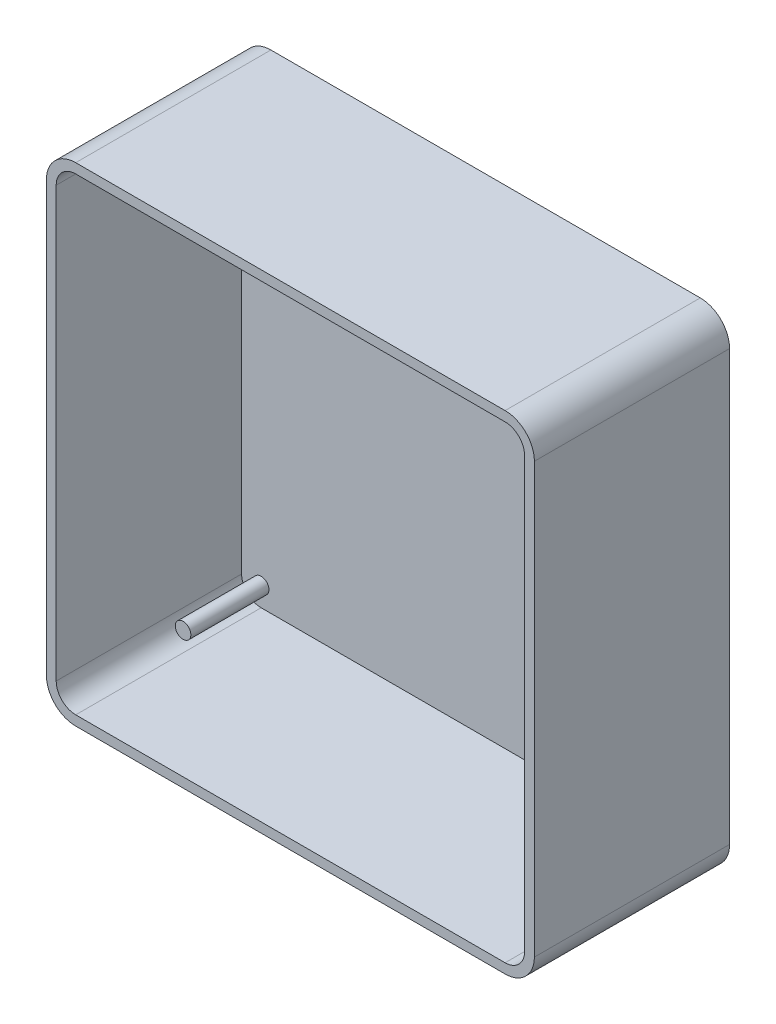
from build123d import *

# Parameters (mm, degrees)
EXTRUDE_4_DEPTH             = 1
EXTRUDE_5_DEPTH             = 19
SKETCH_12_R                 = 0.8
EXTRUDE_7_DEPTH             = 8
SKETCH_13_R                 = 0.5
CUT_EXTRUDE_1_DEPTH         = 3
PATTERN_LINEAR_1_COUNT      = 2
PATTERN_LINEAR_1_PITCH      = 44
PATTERN_LINEAR_1_COUNT_DIR2 = 2
PATTERN_LINEAR_1_PITCH_DIR2 = 44
PATTERN_LINEAR_2_COUNT      = 2
PATTERN_LINEAR_2_PITCH      = 44
PATTERN_LINEAR_2_COUNT_DIR2 = 2
PATTERN_LINEAR_2_PITCH_DIR2 = 44


with BuildPart() as part:
    # 草图1 → 凸台-拉伸4 (new body)
    with BuildSketch(Plane.XY):
        with BuildLine():
            Line((22, 25), (-22, 25))
            ThreePointArc((-22, 25), (-24.121320344, 24.121320344), (-25, 22))
            Line((-25, 22), (-25, -22))
            ThreePointArc((-25, -22), (-24.121320344, -24.121320344), (-22, -25))
            Line((-22, -25), (22, -25))
            ThreePointArc((22, -25), (24.121320344, -24.121320344), (25, -22))
            Line((25, -22), (25, 22))
            ThreePointArc((25, 22), (24.121320344, 24.121320344), (22, 25))
        make_face()
    extrude(amount=EXTRUDE_4_DEPTH)

    # 草图7 → 凸台-拉伸5 (add)
    with BuildSketch(Plane.XY.offset(1)):
        with BuildLine():
            ThreePointArc((22, -25), (24.121320344, -24.121320344), (25, -22))
            Line((25, -22), (25, 22))
            ThreePointArc((25, 22), (24.121320344, 24.121320344), (22, 25))
            Line((22, 25), (-22, 25))
            ThreePointArc((-22, 25), (-24.121320344, 24.121320344), (-25, 22))
            Line((-25, 22), (-25, -22))
            ThreePointArc((-25, -22), (-24.121320344, -24.121320344), (-22, -25))
            Line((-22, -25), (22, -25))
        make_face()
        with BuildLine():
            Line((22, -24), (-22, -24))
            ThreePointArc((-22, -24), (-23.414213562, -23.414213562), (-24, -22))
            Line((-24, -22), (-24, 22))
            ThreePointArc((-24, 22), (-23.414213562, 23.414213562), (-22, 24))
            Line((-22, 24), (22, 24))
            ThreePointArc((22, 24), (23.414213562, 23.414213562), (24, 22))
            Line((24, 22), (24, -22))
            ThreePointArc((24, -22), (23.414213562, -23.414213562), (22, -24))
        make_face(mode=Mode.SUBTRACT)
    extrude(amount=EXTRUDE_5_DEPTH)

    # 草图12 → 凸台-拉伸7 (add)
    with BuildSketch(Plane.XY.offset(1)):
        with Locations((-22, 22)):
            Circle(SKETCH_12_R)
    extrude_7 = extrude(amount=EXTRUDE_7_DEPTH)

    # 草图13 → 切除-拉伸1 (cut)
    with BuildSketch(Plane.XY.offset(9)):
        with Locations((-22, 22)):
            Circle(SKETCH_13_R)
    cut_extrude_1 = extrude(amount=-CUT_EXTRUDE_1_DEPTH, mode=Mode.SUBTRACT)

    # 阵列(线性)1: Extrude 7 2 × 2
    with Locations(*[(i * PATTERN_LINEAR_1_PITCH, -j * PATTERN_LINEAR_1_PITCH_DIR2, 0) for i in range(PATTERN_LINEAR_1_COUNT) for j in range(PATTERN_LINEAR_1_COUNT_DIR2) if (i, j) != (0, 0)]):
        add(extrude_7)

    # 阵列(线性)2: Cut-Extrude 1 2 × 2
    with Locations(*[Vector(1, 0, 0) * (i * PATTERN_LINEAR_2_PITCH) + Vector(1, 0, 0) * (j * PATTERN_LINEAR_2_PITCH_DIR2) for i in range(PATTERN_LINEAR_2_COUNT) for j in range(PATTERN_LINEAR_2_COUNT_DIR2) if (i, j) != (0, 0)]):
        add(cut_extrude_1, mode=Mode.SUBTRACT)


solid = part.part
